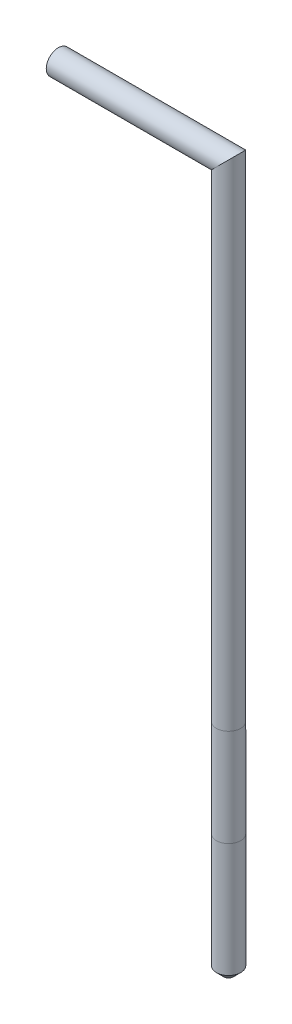
from build123d import *

# Parameters (mm, degrees)
SKETCH_2_R     = 5
CHAMFER_1_SIZE = 3


with BuildPart() as part:
    # По траектории1: sweep along a path in Эскиз1
    with BuildLine(Plane.XY) as sweep_1_path:
        Line((-70, 240), (0, 240))
        Line((0, 240), (0, 40))
        Line((0, 40), (0, 0))
        Line((0, 0), (0, -50))
    # Эскиз2 → По траектории1 (sweep)
    with BuildSketch(Plane(origin=(0, -50, 0), x_dir=(1, 0, 0), z_dir=(0, 1, 0))):
        Circle(SKETCH_2_R)
    sweep(path=sweep_1_path.line, transition=Transition.RIGHT)

    # Фаска1
    chamfer_1_edges = [part.edges().sort_by_distance(p)[0] for p in [
        (-5, -50, 0),
    ]]
    chamfer(chamfer_1_edges, length=CHAMFER_1_SIZE)


solid = part.part
